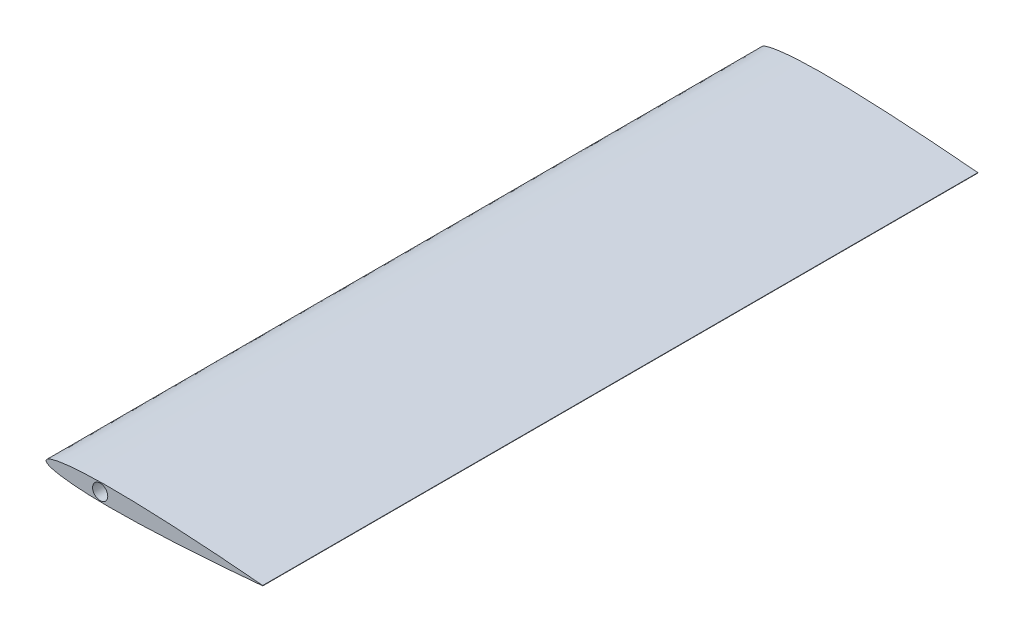
from build123d import *

# Parameters (mm, degrees)
ESTRUSIONE_ESTRUSIONE1_DEPTH = 330
SCHIZZO3_R                   = 3
TAGLIO_ESTRUSIONE1_DEPTH     = 345.864240767
SCHIZZO4_R                   = 3.5
SCHIZZO4_R_2                 = 3
TAGLIO_ESTRUSIONE2_DEPTH     = 20


with BuildPart() as part:
    # Schizzo2 → Estrusione-Estrusione1 (new body)
    with BuildSketch(Plane.XY):
        with BuildLine():
            ThreePointArc((100, 0.084), (100.076652959, 0), (100, -0.084))
            add(Edge.make_bspline(
                [(100, 0.084), (98.333488815, 0.23674648), (95.001194725, 0.542172689), (88.335559621, 1.11089898), (80.003293356, 1.763610995), (70.002998933, 2.457861693), (60.003104625, 3.061747723), (50.003008601, 3.552139212), (40.002598558, 3.902946494), (31.666961486, 4.025260151), (24.9991546, 3.976933791), (19.997775587, 3.844976398), (14.993363131, 3.592486959), (10.827184065, 3.237651579), (7.489054388, 2.814021367), (4.99359465, 2.403673059), (2.84962634, 1.867925494), (1.165413503, 1.320987252), (-0.664613784, 0), (1.165413503, -1.320987252), (2.84962634, -1.867925494), (4.99359465, -2.403673059), (7.489054388, -2.814021367), (10.827184065, -3.237651579), (14.993363131, -3.592486959), (19.997775587, -3.844976398), (24.9991546, -3.976933791), (31.666961486, -4.025260151), (40.002598558, -3.902946494), (50.003008601, -3.552139212), (60.003104625, -3.061747723), (70.002998933, -2.457861693), (80.003293356, -1.763610995), (88.335559621, -1.11089898), (95.001194725, -0.542172689), (98.333488815, -0.23674648), (100, -0.084)],
                knots=[0, 0, 0, 0, 0.024876293, 0.049741715, 0.099443402, 0.149112224, 0.198750974, 0.248359097, 0.29793737, 0.347491327, 0.37226694, 0.397050924, 0.421859475, 0.446731346, 0.459220451, 0.471790602, 0.484560454, 0.491195112, 0.5, 0.508804888, 0.515439546, 0.528209398, 0.540779549, 0.553268654, 0.578140525, 0.602949076, 0.62773306, 0.652508673, 0.70206263, 0.751640903, 0.801249026, 0.850887776, 0.900556598, 0.950258285, 0.975123707, 1, 1, 1, 1], degree=3))
        make_face()
    extrude(amount=ESTRUSIONE_ESTRUSIONE1_DEPTH)

    # Schizzo3 → Taglio-Estrusione1 (cut, through all)
    with BuildSketch(Plane.XY.offset(330)):
        with Locations((25, 0)):
            Circle(SCHIZZO3_R)
    extrude(amount=-TAGLIO_ESTRUSIONE1_DEPTH, mode=Mode.SUBTRACT)

    # Schizzo4 → Taglio-Estrusione2 (cut)
    with BuildSketch(Plane.XY.offset(330)):
        with Locations((25, 0)):
            Circle(SCHIZZO4_R)
        with Locations((25, 0)):
            Circle(SCHIZZO4_R_2, mode=Mode.SUBTRACT)
    extrude(amount=-TAGLIO_ESTRUSIONE2_DEPTH, mode=Mode.SUBTRACT)


solid = part.part
